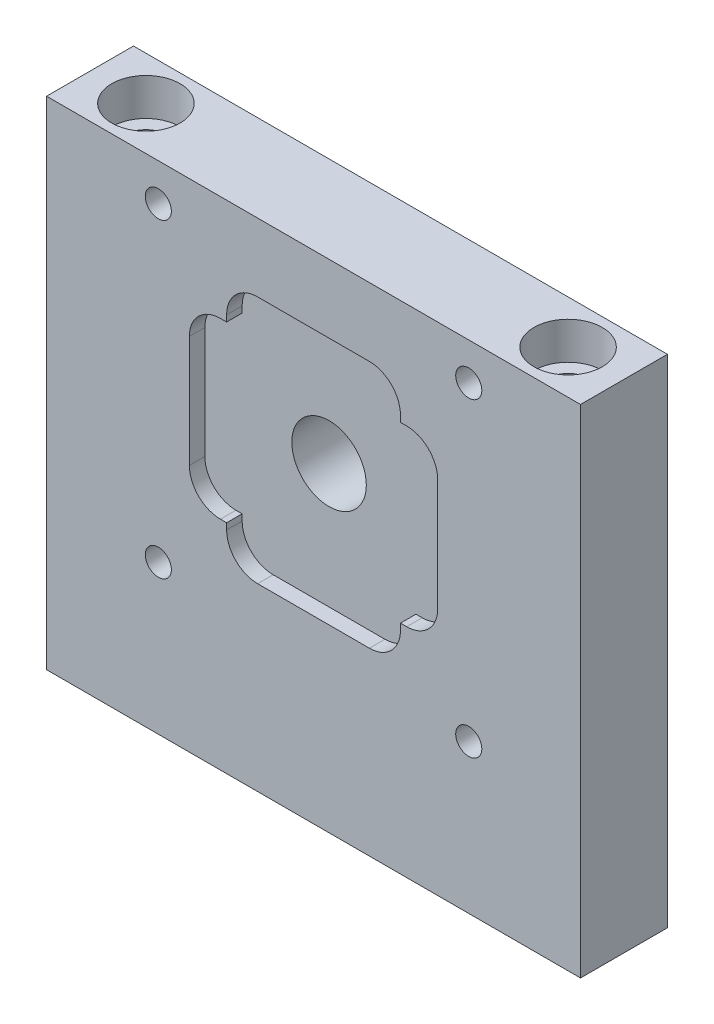
from build123d import *

# Parameters (mm, degrees)
SKETCH_1_W                   = 86
SKETCH_1_H                   = 80
EXTRUDE_1_DEPTH              = 14
SKETCH_2_R                   = 6
CUT_EXTRUDE_1_DEPTH          = 119.287784661
CUT_EXTRUDE_2_DEPTH          = 2.5
FILLET_1_R                   = 5
HOLE_WIZARD_M6_1_D           = 6.6
HOLE_WIZARD_M6_1_CBORE_D     = 11
HOLE_WIZARD_M6_1_CBORE_DEPTH = 6
HOLE_WIZARD_M5_1_D           = 4.2


with BuildPart() as part:
    # 草图1 → 凸台-拉伸1 (new body)
    with BuildSketch(Plane.XY):
        with Locations((43, 40)):
            Rectangle(SKETCH_1_W, SKETCH_1_H)
    extrude(amount=EXTRUDE_1_DEPTH)

    # 草图2 → 切除-拉伸1 (cut, through all)
    with BuildSketch(Plane.XY.offset(14)):
        with Locations((43, 49)):
            Circle(SKETCH_2_R)
    extrude(amount=-CUT_EXTRUDE_1_DEPTH, mode=Mode.SUBTRACT)

    # 草图3 → 切除-拉伸2 (cut)
    with BuildSketch(Plane.XY.offset(14)):
        Polygon((57, 69), (29, 69), (29, 63), (23, 63), (23, 35), (29, 35), (29, 29), (57, 29), (57, 35), (63, 35), (63, 63), (57, 63), align=None)
    extrude(amount=-CUT_EXTRUDE_2_DEPTH, mode=Mode.SUBTRACT)

    # 圆角1
    fillet_1_edges = [part.edges().sort_by_distance(p)[0] for p in [
        (29, 69, 12.75),
        (57, 69, 12.75),
        (63, 63, 12.75),
        (63, 35, 12.75),
        (57, 29, 12.75),
        (29, 29, 12.75),
        (23, 35, 12.75),
        (23, 63, 12.75),
    ]]
    fillet(fillet_1_edges, radius=FILLET_1_R)

    # M6 六角凹头螺钉的柱形沉头孔1 (through all)
    with Locations(Plane(origin=(0, 80, 0), x_dir=(-1, 0, 0), z_dir=(0, 1, 0))):
        with Locations((-9, 7), (-77, 7)):
            CounterBoreHole(HOLE_WIZARD_M6_1_D / 2, HOLE_WIZARD_M6_1_CBORE_D / 2, HOLE_WIZARD_M6_1_CBORE_DEPTH)

    # M5 螺纹孔1 (through all)
    with Locations(Plane.XY.offset(14)):
        with Locations((68, 74), (18, 74), (18, 24), (68, 24)):
            Hole(HOLE_WIZARD_M5_1_D / 2)


solid = part.part
